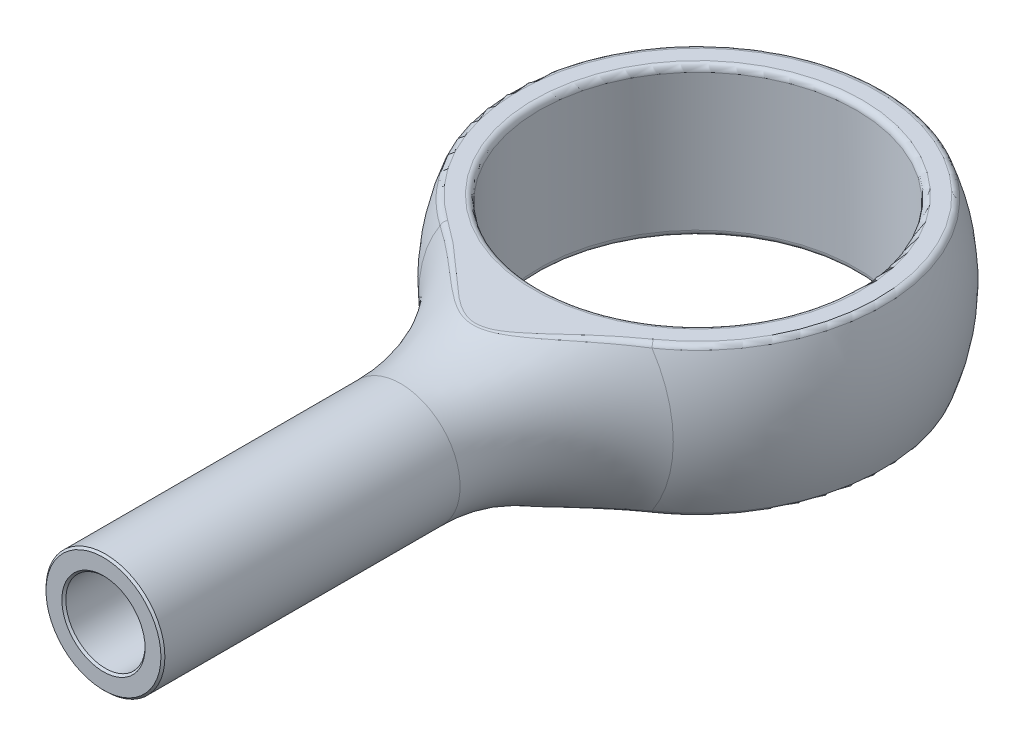
from build123d import *

# Parameters (mm, degrees)
CUT_EXTRUDE1_DEPTH      = 17.583123952
CUT_EXTRUDE1_DEPTH_BACK = 17.583123952
CUT_EXTRUDE2_DEPTH      = 16.922174015
CUT_EXTRUDE2_DEPTH_BACK = 16.922174015
SKETCH4_R               = 4
FILLET1_R               = 0.15
SKETCH5_R               = 1
CUT_EXTRUDE4_DEPTH      = 5
CHAMFER1_SIZE           = 0.05


with BuildPart() as part:
    # Sketch2 → Revolve1 (revolve)
    with BuildSketch(Plane(origin=(0, 0, 0), x_dir=(1, 0, 0), z_dir=(0, 1, 0))):
        with BuildLine():
            Line((-1.5, -15), (0, -15))
            Line((0, -15), (0, 5))
            ThreePointArc((0, 5), (-4.698967117, 1.708715315), (-3.211678832, -3.832116788))
            ThreePointArc((-3.211678832, -3.832116788), (-1.948980687, -5.476190987), (-1.5, -7.5))
            Line((-1.5, -7.5), (-1.5, -15))
        make_face()
    revolve(axis=Axis((0, 0, -5), (0, 0, 1)))

    # Sketch3 → Cut-Extrude1 (cut, two sides: drawn at the far end of the back side and taken through both)
    with BuildSketch(Plane(origin=(0, 0, 0), x_dir=(0, 0, -1), z_dir=(1, 0, 0)).offset(-CUT_EXTRUDE1_DEPTH_BACK)):
        with BuildLine():
            Line((-16.419967232, 7.534431005), (5.115153484, 7.534431005))
            Line((5.115153484, 7.534431005), (5.115153484, 1.875))
            Line((5.115153484, 1.875), (-6.760968178, 1.875))
            ThreePointArc((-6.760968178, 1.875), (-8.264497175, 2.106415246), (-9.62885036, 2.779239779))
            Line((-9.62885036, 2.779239779), (-16.419967232, 7.534431005))
        make_face()
        with BuildLine():
            Line((-9.62885036, -2.779239779), (-16.419967232, -7.534431005))
            Line((-16.419967232, -7.534431005), (5.115153484, -7.534431005))
            Line((5.115153484, -7.534431005), (5.115153484, -1.875))
            Line((5.115153484, -1.875), (-6.760968178, -1.875))
            ThreePointArc((-6.760968178, -1.875), (-8.264497175, -2.106415246), (-9.62885036, -2.779239779))
        make_face()
    extrude(amount=CUT_EXTRUDE1_DEPTH + CUT_EXTRUDE1_DEPTH_BACK, mode=Mode.SUBTRACT)

    # Sketch4 → Cut-Extrude2 (cut, two sides: drawn at the far end of the back side and taken through both)
    with BuildSketch(Plane(origin=(0, 0, 0), x_dir=(1, 0, 0), z_dir=(0, 1, 0)).offset(-CUT_EXTRUDE2_DEPTH_BACK)):
        with Locations(Location((0, 0, 0), (0, 0, 270))):
            Circle(SKETCH4_R)
    extrude(amount=CUT_EXTRUDE2_DEPTH + CUT_EXTRUDE2_DEPTH_BACK, mode=Mode.SUBTRACT)

    # Fillet1
    fillet1_edges = [part.edges().sort_by_distance(p)[0] for p in [
        (1e-09, -1.875, 5.642942998),
        (-1e-09, 1.875, 5.642942998),
        (0, 1.875, -4.635124054),
        (0, -1.875, -4.635124054),
        (0, -1.875, -4),
        (0, 1.875, -4),
    ]]
    fillet(fillet1_edges, radius=FILLET1_R)

    # Sketch5 → Cut-Extrude4 (cut)
    with BuildSketch(Plane.XY.offset(15)):
        Circle(SKETCH5_R)
    extrude(amount=-CUT_EXTRUDE4_DEPTH, mode=Mode.SUBTRACT)

    # Chamfer1
    chamfer1_edges = [part.edges().sort_by_distance(p)[0] for p in [
        (1.5, 0, 15),
        (-1, 0, 15),
    ]]
    chamfer(chamfer1_edges, length=CHAMFER1_SIZE)


solid = part.part
